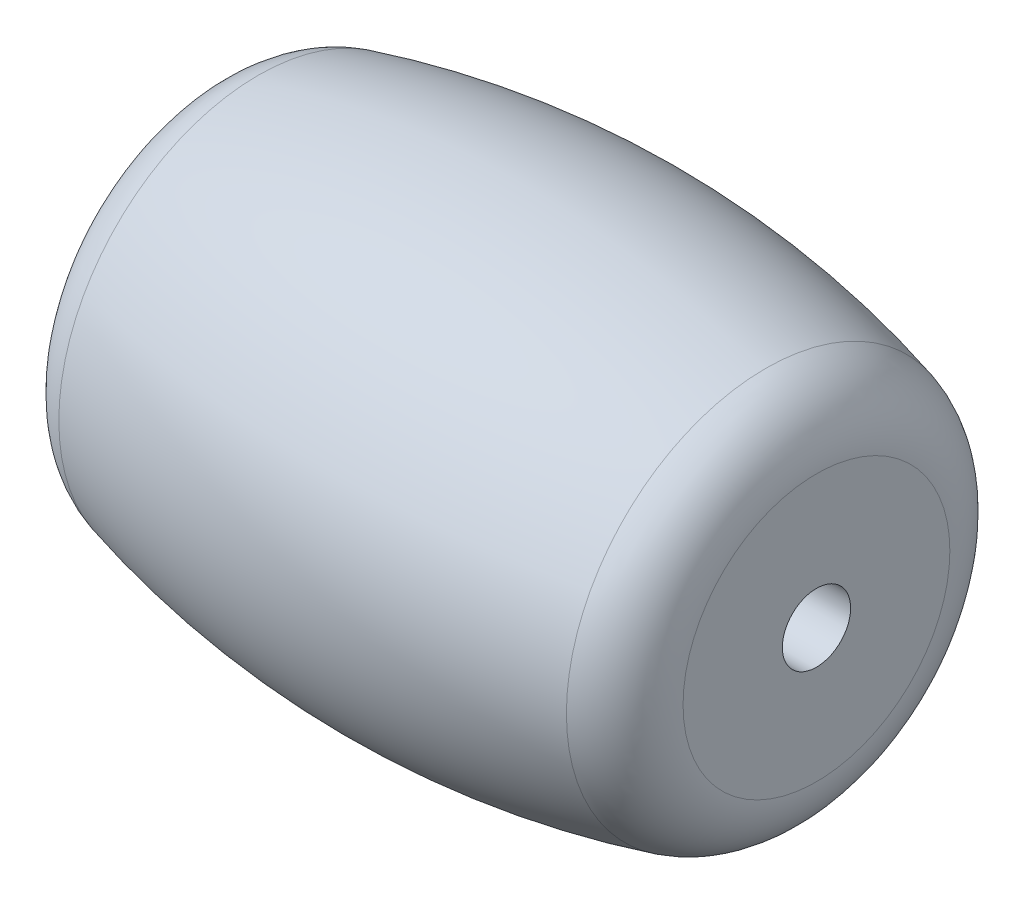
from build123d import *

# Parameters (mm, degrees)
CONG_1_R                = 3
ESQUISSE2_R             = 1.5
ENL_V_MAT_EXTRU_1_DEPTH = 31.404922454


with BuildPart() as part:
    # Esquisse1 → Révolution1 (revolve)
    with BuildSketch(Plane.XY, mode=Mode.PRIVATE) as r_volution1_sk:
        with BuildLine():
            Line((-13.375, 0), (-13.375, 8.1))
            ThreePointArc((-13.375, 8.1), (0, 10.22), (13.375, 8.1))
            Line((13.375, 8.1), (13.375, 0))
            Line((13.375, 0), (-13.375, 0))
        make_face()
    revolve(r_volution1_sk.sketch.rotate(Axis((0, 0, 0), (-1, 0, 0)), 90), axis=Axis((0, 0, 0), (-1, 0, 0)))

    # Congé1
    cong_1_edges = [part.edges().sort_by_distance(p)[0] for p in [
        (-13.375, 0, 8.1),
        (13.375, 0, 8.1),
    ]]
    fillet(cong_1_edges, radius=CONG_1_R)

    # Esquisse2 → Enlèv. mat.-Extru.1 (cut, through all)
    with BuildSketch(Plane(origin=(13.375, 0, 0), x_dir=(0, 0, -1), z_dir=(1, 0, 0))):
        Circle(ESQUISSE2_R)
    extrude(amount=-ENL_V_MAT_EXTRU_1_DEPTH, mode=Mode.SUBTRACT)


solid = part.part
